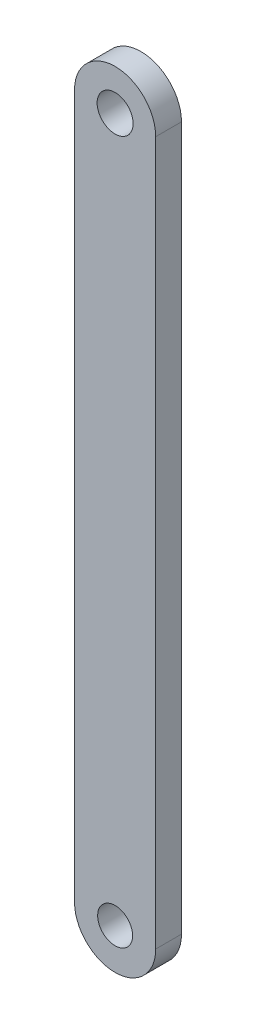
from build123d import *

# Parameters (mm, degrees)
ESBO_O1_R                = 3.325
ESBO_O1_R_2              = 3.225
RESSALTO_EXTRUS_O1_DEPTH = 4.7625


with BuildPart() as part:
    # Esboço1 → Ressalto-extrusão1 (new body)
    with BuildSketch(Plane.XY):
        with BuildLine():
            Line((-7.5, 0), (-7.5, 130))
            ThreePointArc((-7.5, 130), (0, 137.5), (7.5, 130))
            Line((7.5, 130), (7.5, 0))
            ThreePointArc((7.5, 0), (0, -7.5), (-7.5, 0))
        make_face()
        with Locations(Location((0, 130, 0), (0, 0, 180))):
            Circle(ESBO_O1_R, mode=Mode.SUBTRACT)
        with Locations(Location((0, 0, 0), (0, 0, 180))):
            Circle(ESBO_O1_R_2, mode=Mode.SUBTRACT)
    extrude(amount=RESSALTO_EXTRUS_O1_DEPTH)


solid = part.part
